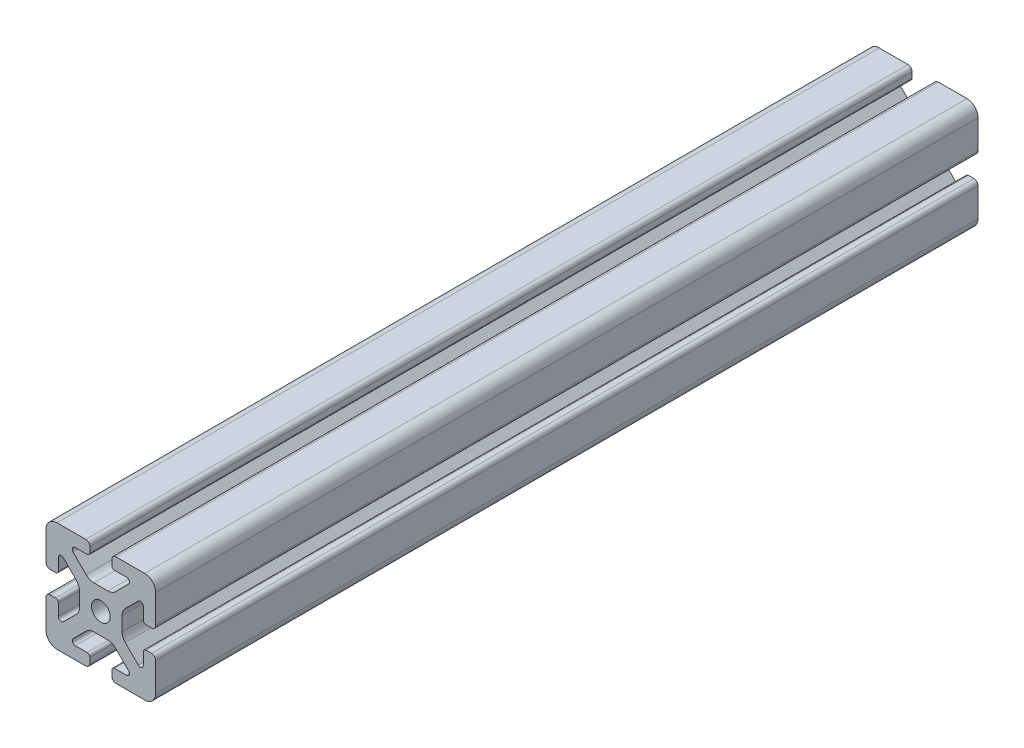
from build123d import *

# Parameters (mm, degrees)
SKETCH1_R           = 3.4
BOSS_EXTRUDE1_DEPTH = 300


with BuildPart() as part:
    # Sketch1 → Boss-Extrude1 (new body)
    with BuildSketch(Plane.XY):
        with BuildLine():
            Line((-9.342973311, 15.5), (-5, 15.5))
            ThreePointArc((-5, 15.5), (-4.292893219, 15.792893219), (-4, 16.5))
            Line((-4, 16.5), (-4, 18.5))
            ThreePointArc((-4, 18.5), (-4.439339828, 19.560660172), (-5.5, 20))
            Line((-5.5, 20), (-16, 20))
            ThreePointArc((-16, 20), (-18.828427125, 18.828427125), (-20, 16))
            Line((-20, 16), (-20, 5.5))
            ThreePointArc((-20, 5.5), (-19.560660172, 4.439339828), (-18.5, 4))
            Line((-18.5, 4), (-16.5, 4))
            ThreePointArc((-16.5, 4), (-15.792893219, 4.292893219), (-15.5, 5))
            Line((-15.5, 5), (-15.5, 9.342973311))
            ThreePointArc((-15.5, 9.342973311), (-14.833298107, 10.340763206), (-13.656324676, 10.106648635))
            Line((-13.656324676, 10.106648635), (-8.921572875, 5.371896834))
            ThreePointArc((-8.921572875, 5.371896834), (-8.05448187, 4.074203438), (-7.75, 2.543469709))
            Line((-7.75, 2.543469709), (-7.75, -2.543469709))
            ThreePointArc((-7.75, -2.543469709), (-8.05448187, -4.074203438), (-8.921572875, -5.371896834))
            Line((-8.921572875, -5.371896834), (-13.656324676, -10.106648635))
            ThreePointArc((-13.656324676, -10.106648635), (-14.833298107, -10.340763206), (-15.5, -9.342973311))
            Line((-15.5, -9.342973311), (-15.5, -5))
            ThreePointArc((-15.5, -5), (-15.792893219, -4.292893219), (-16.5, -4))
            Line((-16.5, -4), (-18.5, -4))
            ThreePointArc((-18.5, -4), (-19.560660172, -4.439339828), (-20, -5.5))
            Line((-20, -5.5), (-20, -16))
            ThreePointArc((-20, -16), (-18.828427125, -18.828427125), (-16, -20))
            Line((-16, -20), (-5.5, -20))
            ThreePointArc((-5.5, -20), (-4.439339828, -19.560660172), (-4, -18.5))
            Line((-4, -18.5), (-4, -16.5))
            ThreePointArc((-4, -16.5), (-4.292893219, -15.792893219), (-5, -15.5))
            Line((-5, -15.5), (-9.342973311, -15.5))
            ThreePointArc((-9.342973311, -15.5), (-10.340763206, -14.833298107), (-10.106648635, -13.656324676))
            Line((-10.106648635, -13.656324676), (-5.371896834, -8.921572875))
            ThreePointArc((-5.371896834, -8.921572875), (-4.074203438, -8.05448187), (-2.543469709, -7.75))
            Line((-2.543469709, -7.75), (2.543469709, -7.75))
            ThreePointArc((2.543469709, -7.75), (4.074203438, -8.05448187), (5.371896834, -8.921572875))
            Line((5.371896834, -8.921572875), (10.106648635, -13.656324676))
            ThreePointArc((10.106648635, -13.656324676), (10.340763206, -14.833298107), (9.342973311, -15.5))
            Line((9.342973311, -15.5), (5, -15.5))
            ThreePointArc((5, -15.5), (4.292893219, -15.792893219), (4, -16.5))
            Line((4, -16.5), (4, -18.5))
            ThreePointArc((4, -18.5), (4.439339828, -19.560660172), (5.5, -20))
            Line((5.5, -20), (16, -20))
            ThreePointArc((16, -20), (18.828427125, -18.828427125), (20, -16))
            Line((20, -16), (20, -5.5))
            ThreePointArc((20, -5.5), (19.560660172, -4.439339828), (18.5, -4))
            Line((18.5, -4), (16.5, -4))
            ThreePointArc((16.5, -4), (15.792893219, -4.292893219), (15.5, -5))
            Line((15.5, -5), (15.5, -9.342973311))
            ThreePointArc((15.5, -9.342973311), (14.833298107, -10.340763206), (13.656324676, -10.106648635))
            Line((13.656324676, -10.106648635), (8.921572875, -5.371896834))
            ThreePointArc((8.921572875, -5.371896834), (8.05448187, -4.074203438), (7.75, -2.543469709))
            Line((7.75, -2.543469709), (7.75, 2.543469709))
            ThreePointArc((7.75, 2.543469709), (8.05448187, 4.074203438), (8.921572875, 5.371896834))
            Line((8.921572875, 5.371896834), (13.656324676, 10.106648635))
            ThreePointArc((13.656324676, 10.106648635), (14.833298107, 10.340763206), (15.5, 9.342973311))
            Line((15.5, 9.342973311), (15.5, 5))
            ThreePointArc((15.5, 5), (15.792893219, 4.292893219), (16.5, 4))
            Line((16.5, 4), (18.5, 4))
            ThreePointArc((18.5, 4), (19.560660172, 4.439339828), (20, 5.5))
            Line((20, 5.5), (20, 16))
            ThreePointArc((20, 16), (18.828427125, 18.828427125), (16, 20))
            Line((16, 20), (5.5, 20))
            ThreePointArc((5.5, 20), (4.439339828, 19.560660172), (4, 18.5))
            Line((4, 18.5), (4, 16.5))
            ThreePointArc((4, 16.5), (4.292893219, 15.792893219), (5, 15.5))
            Line((5, 15.5), (9.342973311, 15.5))
            ThreePointArc((9.342973311, 15.5), (10.340763206, 14.833298107), (10.106648635, 13.656324676))
            Line((10.106648635, 13.656324676), (5.371896834, 8.921572875))
            ThreePointArc((5.371896834, 8.921572875), (4.074203438, 8.05448187), (2.543469709, 7.75))
            Line((2.543469709, 7.75), (-2.543469709, 7.75))
            ThreePointArc((-2.543469709, 7.75), (-4.074203438, 8.05448187), (-5.371896834, 8.921572875))
            Line((-5.371896834, 8.921572875), (-10.106648635, 13.656324676))
            ThreePointArc((-10.106648635, 13.656324676), (-10.340763206, 14.833298107), (-9.342973311, 15.5))
        make_face()
        Circle(SKETCH1_R, mode=Mode.SUBTRACT)
    extrude(amount=BOSS_EXTRUDE1_DEPTH)


solid = part.part
